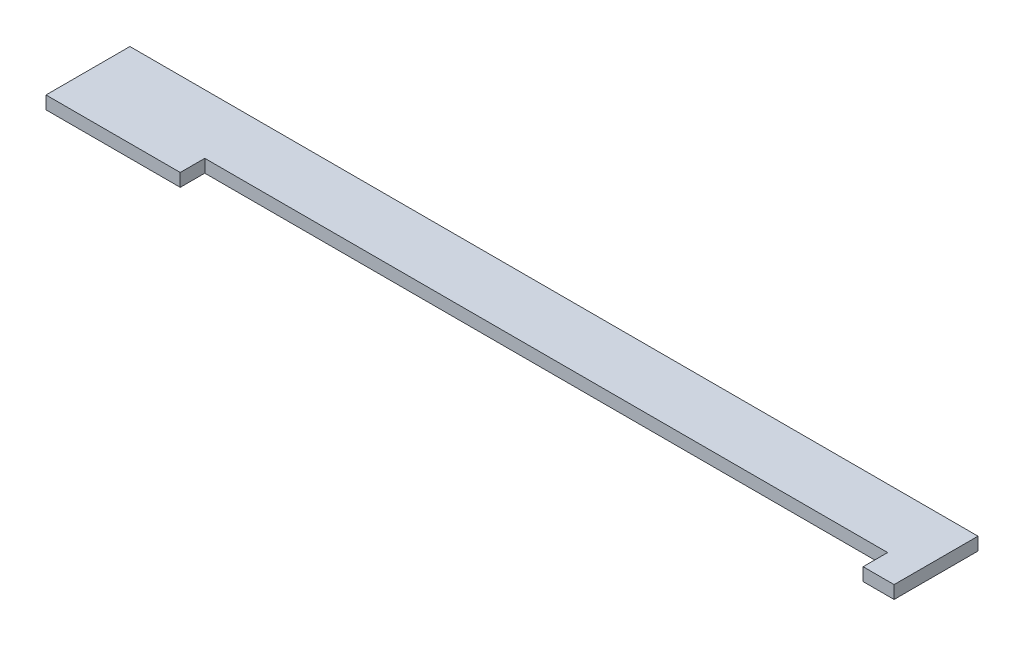
from build123d import *

# Parameters (mm, degrees)
BOSS_EXTRUDE1_DEPTH = 10


with BuildPart() as part:
    # Sketch1 → Boss-Extrude1 (new body)
    with BuildSketch(Plane(origin=(0, 0, 0), x_dir=(1, 0, 0), z_dir=(0, 1, 0))):
        Polygon((-62.196458392, 37.369127517), (-62.196458392, -27.630872483), (41.803541608, -27.630872483), (41.803541608, -8.630872483), (570.803541608, -8.630872483), (570.803541608, -27.630872483), (594.803541608, -27.630872483), (594.803541608, 37.369127517), align=None)
    extrude(amount=BOSS_EXTRUDE1_DEPTH)


solid = part.part
